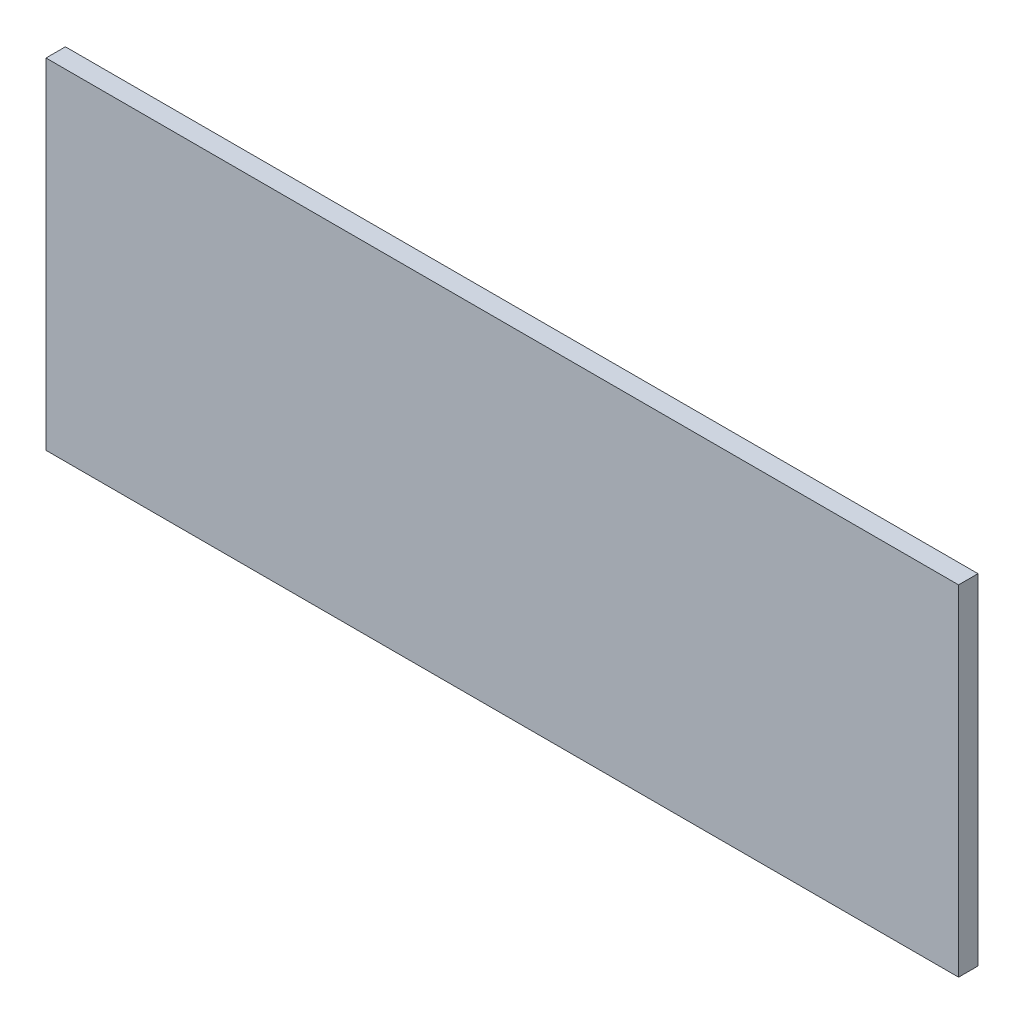
from build123d import *

# Parameters (mm, degrees)
ESQUISSE1_W        = 470
ESQUISSE1_H        = 175
BOSS_EXTRU_1_DEPTH = 10


with BuildPart() as part:
    # Esquisse1 → Boss.-Extru.1 (new body)
    with BuildSketch(Plane.XY):
        with Locations((235, 87.5)):
            Rectangle(ESQUISSE1_W, ESQUISSE1_H)
    extrude(amount=BOSS_EXTRU_1_DEPTH)


solid = part.part
